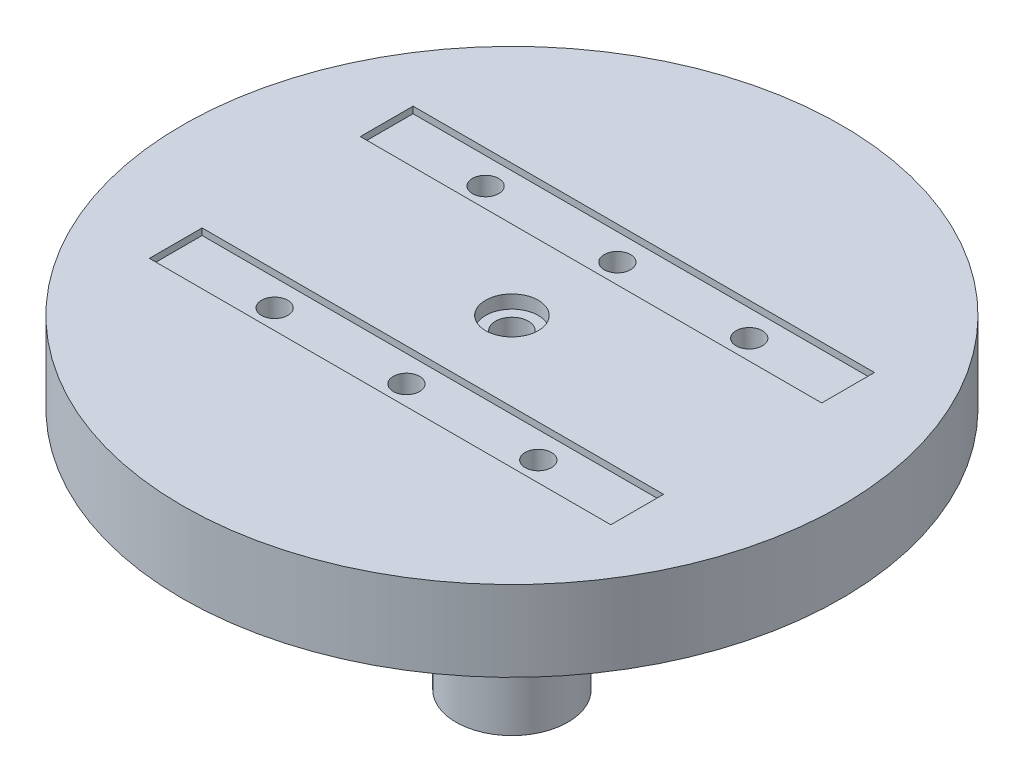
from build123d import *

# Parameters (mm, degrees)
SKETCH3_R            = 50
BOSS_EXTRUDE1_DEPTH  = 12.2
SKETCH4_W            = 70
SKETCH4_H            = 8
CUT_EXTRUDE2_DEPTH   = 1
SKETCH7_R            = 2
CUT_EXTRUDE4_DEPTH   = 72.755417914
SKETCH8_R            = 8.5
CUT_EXTRUDE6_DEPTH   = 3
SKETCH9_R            = 4
CUT_EXTRUDE7_DEPTH   = 2
SKETCH11_R           = 2.5
CUT_EXTRUDE8_DEPTH   = 72.442564344
SKETCH16_R           = 8.5
BOSS_EXTRUDE6_DEPTH  = 40
SKETCH21_R           = 10
BOSS_EXTRUDE11_DEPTH = 2
SKETCH22_R           = 10
BOSS_EXTRUDE12_DEPTH = 2
SKETCH23_R           = 20
BOSS_EXTRUDE13_DEPTH = 12
FILLET1_R            = 2
SKETCH24_R           = 2.5
SKETCH24_R_2         = 2.25
BOSS_EXTRUDE14_DEPTH = 4


with BuildPart() as part:
    # Sketch3 → Boss-Extrude1 (new body)
    with BuildSketch(Plane(origin=(0, 0, 0), x_dir=(1, 0, 0), z_dir=(0, 1, 0))):
        with Locations(Location((0, 0, 0), (0, 0, 270))):
            Circle(SKETCH3_R)
    extrude(amount=BOSS_EXTRUDE1_DEPTH)

    # Sketch4 → Cut-Extrude2 (cut)
    with BuildSketch(Plane(origin=(0, 12.2, 0), x_dir=(1, 0, 0), z_dir=(0, 1, 0))):
        with Locations((0, -16)):
            Rectangle(SKETCH4_W, SKETCH4_H)
        with Locations((0, 16)):
            Rectangle(SKETCH4_W, SKETCH4_H)
    extrude(amount=-CUT_EXTRUDE2_DEPTH, mode=Mode.SUBTRACT)

    # Sketch7 → Cut-Extrude4 (cut, through all)
    with BuildSketch(Plane(origin=(0, 12.2, 0), x_dir=(1, 0, 0), z_dir=(0, 1, 0))):
        with Locations(Location((0, 16, 0), (0, 0, 270))):
            Circle(SKETCH7_R)
        with Locations(Location((0, -16, 0), (0, 0, 270))):
            Circle(SKETCH7_R)
        with Locations(Location((-20, -16, 0), (0, 0, 270))):
            Circle(SKETCH7_R)
        with Locations(Location((-20, 16, 0), (0, 0, 270))):
            Circle(SKETCH7_R)
        with Locations(Location((20, 16, 0), (0, 0, 270))):
            Circle(SKETCH7_R)
        with Locations(Location((20, -16, 0), (0, 0, 270))):
            Circle(SKETCH7_R)
    extrude(amount=-CUT_EXTRUDE4_DEPTH, mode=Mode.SUBTRACT)

    # Sketch8 → Cut-Extrude6 (cut)
    with BuildSketch(Plane(origin=(0, 0, 0), x_dir=(-1, 0, 0), z_dir=(0, -1, 0))):
        with Locations(Location((0, 0, 0), (0, 0, 90))):
            Circle(SKETCH8_R)
    extrude(amount=-CUT_EXTRUDE6_DEPTH, mode=Mode.SUBTRACT)

    # Sketch9 → Cut-Extrude7 (cut)
    with BuildSketch(Plane(origin=(0, 12.2, 0), x_dir=(1, 0, 0), z_dir=(0, 1, 0))):
        with Locations(Location((0, 0, 0), (0, 0, 270))):
            Circle(SKETCH9_R)
    extrude(amount=-CUT_EXTRUDE7_DEPTH, mode=Mode.SUBTRACT)

    # Sketch11 → Cut-Extrude8 (cut, through all)
    with BuildSketch(Plane(origin=(0, 10.2, 0), x_dir=(1, 0, 0), z_dir=(0, 1, 0))):
        with Locations(Location((0, 0, 0), (0, 0, 270))):
            Circle(SKETCH11_R)
    extrude(amount=-CUT_EXTRUDE8_DEPTH, mode=Mode.SUBTRACT)


with BuildPart() as body_2:
    # Sketch16 → Boss-Extrude6 (new body)
    with BuildSketch(Plane.XZ.offset(-3)):
        with Locations(Location((0, 0, 0), (0, 0, 270))):
            Circle(SKETCH16_R)
    extrude(amount=BOSS_EXTRUDE6_DEPTH)

    # Sketch24 → Boss-Extrude14 (add)
    with BuildSketch(Plane(origin=(0, -37, 0), x_dir=(-1, 0, 0), z_dir=(0, -1, 0))):
        with Locations(Location((0, 0, 0), (0, 0, 90))):
            Circle(SKETCH24_R)
        with Locations(Location((0, 0, 0), (0, 0, 90))):
            Circle(SKETCH24_R_2, mode=Mode.SUBTRACT)
    extrude(amount=BOSS_EXTRUDE14_DEPTH)


with BuildPart() as body_3:
    # Sketch21 → Boss-Extrude11 (new body)
    with BuildSketch(Plane.XZ):
        with Locations(Location((0, 0, 0), (0, 0, 270))):
            Circle(SKETCH21_R)
    extrude(amount=BOSS_EXTRUDE11_DEPTH)


with BuildPart() as body_4:
    # Sketch22 → Boss-Extrude12 (new body)
    with BuildSketch(Plane.XZ.offset(2)):
        with Locations(Location((0, 0, 0), (0, 0, 270))):
            Circle(SKETCH22_R)
    extrude(amount=BOSS_EXTRUDE12_DEPTH)


with BuildPart() as body_5:
    # Sketch23 → Boss-Extrude13 (new body)
    with BuildSketch(Plane(origin=(0, -4, 0), x_dir=(-1, 0, 0), z_dir=(0, -1, 0))):
        with Locations(Location((0, 0, 0), (0, 0, 90))):
            Circle(SKETCH23_R)
    extrude(amount=BOSS_EXTRUDE13_DEPTH)

    # Fillet1
    fillet1_edges = [body_5.edges().sort_by_distance(p)[0] for p in [
        (0, -4, 20),
        (0, -16, 20),
    ]]
    fillet(fillet1_edges, radius=FILLET1_R)


solid = Compound([part.part, body_2.part, body_3.part, body_4.part, body_5.part])
